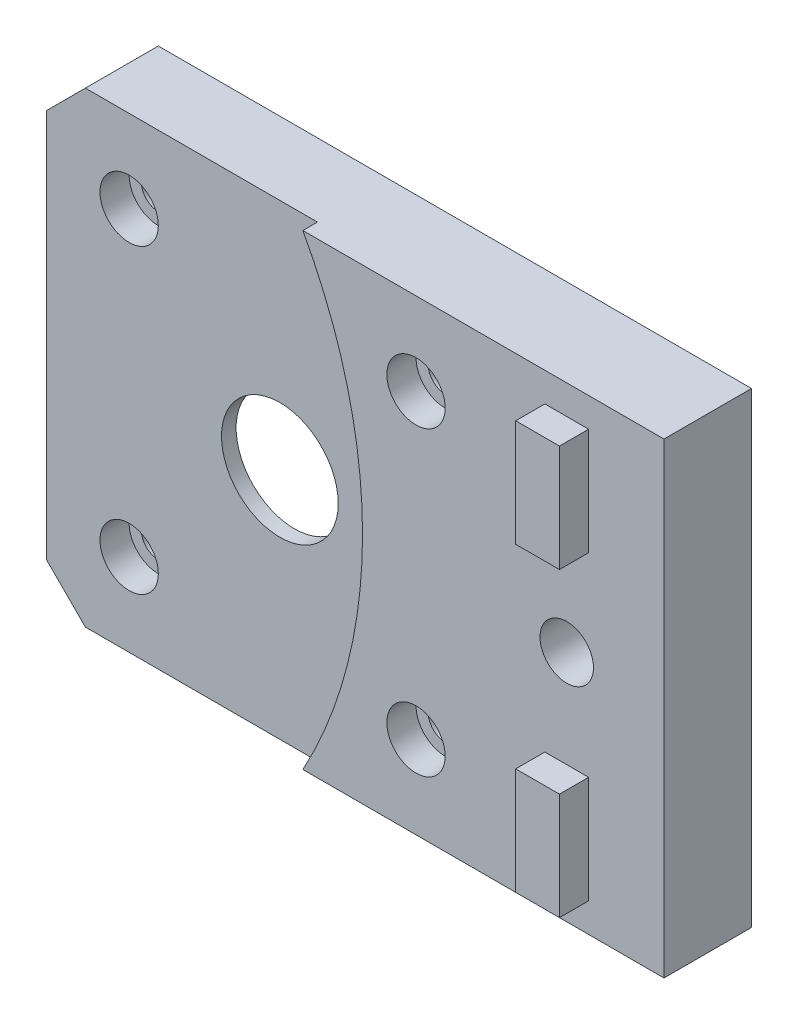
from build123d import *

# Parameters (mm, degrees)
SKETCH1_W                = 20
SKETCH1_H                = 42
SKETCH1_W_2              = 42
BOSS_EXTRUDE1_DEPTH      = 6
SKETCH2_R                = 11.25
CUT_EXTRUDE1_DEPTH       = 3
CUT_EXTRUDE2_DEPTH       = 47.454278597
CUT_EXTRUDE2_DEPTH_BACK  = 47.454278597
SKETCH3_R                = 1.75
SKETCH3_R_2              = 6
CUT_EXTRUDE3_START       = -3
SKETCH4_R                = 3
SKETCH4_R_2              = 1.75
CUT_EXTRUDE3_DEPTH       = 3
SKETCH5_W                = 4.5
SKETCH5_H                = 42
BOSS_EXTRUDE2_DEPTH      = 3
CHAMFER1_SIZE            = 3
CUT_EXTRUDE4_DEPTH       = 47.936126811
CUT_EXTRUDE4_DEPTH_BACK  = 47.936126811
SKETCH6_R                = 2.75
SKETCH7_W                = 9.456435582
SKETCH7_H                = 20
SKETCH7_R                = 2.75
CUT_EXTRUDE5_DEPTH       = 47.454278597
BOSS_EXTRUDE4_DEPTH      = 3
BOSS_EXTRUDE4_DEPTH_BACK = 6
SKETCH8_W                = 20
SKETCH8_H                = 42
SKETCH8_R                = 7
CHAMFER2_SIZE            = 4
SKETCH9_R                = 50
CUT_EXTRUDE7_DEPTH       = 1.5
CUT_EXTRUDE8_START       = -1.5
SKETCH10_R               = 3
CUT_EXTRUDE8_DEPTH       = 1.5


with BuildPart() as part:
    # Sketch1 → Boss-Extrude1 (new body)
    with BuildSketch(Plane.XY):
        with Locations((31, 0)):
            Rectangle(SKETCH1_W, SKETCH1_H)
        Rectangle(SKETCH1_W_2, SKETCH1_H)
    extrude(amount=BOSS_EXTRUDE1_DEPTH)

    # Sketch2 → Cut-Extrude1 (cut)
    with BuildSketch(Plane.XY):
        Circle(SKETCH2_R)
    extrude(amount=CUT_EXTRUDE1_DEPTH, mode=Mode.SUBTRACT)

    # Sketch3 → Cut-Extrude2 (cut, two sides: drawn at the far end of the back side and taken through both)
    with BuildSketch(Plane.XY.offset(-CUT_EXTRUDE2_DEPTH_BACK)):
        with Locations((-15.499780644, 15.499780644)):
            Circle(SKETCH3_R)
        Circle(SKETCH3_R_2)
        with Locations((15.499780644, 15.499780644)):
            Circle(SKETCH3_R)
        with Locations((15.499780644, -15.499780644)):
            Circle(SKETCH3_R)
        with Locations((-15.499780644, -15.499780644)):
            Circle(SKETCH3_R)
    extrude(amount=CUT_EXTRUDE2_DEPTH + CUT_EXTRUDE2_DEPTH_BACK, mode=Mode.SUBTRACT)

    # Sketch4 → Cut-Extrude3 (cut)
    # profile 1 of 4: a face of its own
    with BuildSketch(Plane.XY.offset(6).offset(CUT_EXTRUDE3_START)):
        with Locations((-15.499780644, -15.499780644)):
            Circle(SKETCH4_R)
        with Locations((-15.499780644, -15.499780644)):
            Circle(SKETCH4_R_2, mode=Mode.SUBTRACT)
    # profile 2 of 4: a face of its own
    with BuildSketch(Plane.XY.offset(6).offset(CUT_EXTRUDE3_START)):
        with Locations((-15.499780644, 15.499780644)):
            Circle(SKETCH4_R)
        with Locations((-15.499780644, 15.499780644)):
            Circle(SKETCH4_R_2, mode=Mode.SUBTRACT)
    # profile 3 of 4: a face of its own
    with BuildSketch(Plane.XY.offset(6).offset(CUT_EXTRUDE3_START)):
        with Locations((15.499780644, 15.499780644)):
            Circle(SKETCH4_R)
        with Locations((15.499780644, 15.499780644)):
            Circle(SKETCH4_R_2, mode=Mode.SUBTRACT)
    # profile 4 of 4: a face of its own
    with BuildSketch(Plane.XY.offset(6).offset(CUT_EXTRUDE3_START)):
        with Locations((15.499780644, -15.499780644)):
            Circle(SKETCH4_R)
        with Locations((15.499780644, -15.499780644)):
            Circle(SKETCH4_R_2, mode=Mode.SUBTRACT)
    extrude(amount=CUT_EXTRUDE3_DEPTH, mode=Mode.SUBTRACT)

    # Sketch5 → Boss-Extrude2 (add)
    with BuildSketch(Plane.XY.offset(6)):
        with Locations((31, 0)):
            Rectangle(SKETCH5_W, SKETCH5_H)
    extrude(amount=BOSS_EXTRUDE2_DEPTH)

    # Chamfer1
    chamfer1_edges = [part.edges().sort_by_distance(p)[0] for p in [
        (-21, -21, 3),
        (-21, 21, 3),
    ]]
    chamfer(chamfer1_edges, length=CHAMFER1_SIZE)

    # Sketch6 → Cut-Extrude4 (cut, two sides: drawn at the far end of the back side and taken through both)
    with BuildSketch(Plane(origin=(0, 0, 0), x_dir=(-1, 0, 0), z_dir=(0, 0, -1)).offset(-CUT_EXTRUDE4_DEPTH_BACK)):
        with Locations(Location((-31, 0, 0), (0, 0, 324.903198772))):
            Circle(SKETCH6_R)
    extrude(amount=CUT_EXTRUDE4_DEPTH + CUT_EXTRUDE4_DEPTH_BACK, mode=Mode.SUBTRACT)

    # Sketch7 → Cut-Extrude5 (cut, through all)
    with BuildSketch(Plane.XY.offset(6)):
        with Locations((31, 0)):
            Rectangle(SKETCH7_W, SKETCH7_H)
        with Locations((31, 0)):
            Circle(SKETCH7_R, mode=Mode.SUBTRACT)
    extrude(amount=CUT_EXTRUDE5_DEPTH, mode=Mode.SUBTRACT)

    # Sketch8 → Boss-Extrude4 (add, two sides: drawn at the far end of the back side and taken through both)
    # profile 1 of 2: a face of its own
    with BuildSketch(Plane(origin=(0, 0, 0), x_dir=(-1, 0, 0), z_dir=(0, 0, -1)).offset(-BOSS_EXTRUDE4_DEPTH_BACK)):
        Polygon((18, -21), (-21, -21), (-41, -21), (-41, -24), (24, -24), (24, 24), (-41, 24), (-41, 21), (-21, 21), (18, 21), (21, 18), (21, -18), align=None)
    # profile 2 of 2: a face of its own
    with BuildSketch(Plane(origin=(0, 0, 0), x_dir=(-1, 0, 0), z_dir=(0, 0, -1)).offset(-BOSS_EXTRUDE4_DEPTH_BACK)):
        with Locations((-31, 0)):
            Rectangle(SKETCH8_W, SKETCH8_H)
        with Locations((-31, 0)):
            Circle(SKETCH8_R, mode=Mode.SUBTRACT)
    extrude(amount=BOSS_EXTRUDE4_DEPTH + BOSS_EXTRUDE4_DEPTH_BACK)

    # Chamfer2
    chamfer2_edges = [part.edges().sort_by_distance(p)[0] for p in [
        (-24, 24, 1.5),
        (-24, -24, 1.5),
    ]]
    chamfer(chamfer2_edges, length=CHAMFER2_SIZE)

    # Sketch9 → Cut-Extrude7 (cut)
    with BuildSketch(Plane.XY.offset(6)):
        with Locations((-40, 0)):
            Circle(SKETCH9_R)
    extrude(amount=-CUT_EXTRUDE7_DEPTH, mode=Mode.SUBTRACT)

    # Sketch10 → Cut-Extrude8 (cut)
    with BuildSketch(Plane.XY.offset(3).offset(CUT_EXTRUDE8_START)):
        with Locations((-15.499780644, 15.499780644)):
            Circle(SKETCH10_R)
        with Locations((-15.499780644, -15.499780644)):
            Circle(SKETCH10_R)
    extrude(amount=CUT_EXTRUDE8_DEPTH, mode=Mode.SUBTRACT)


solid = part.part
